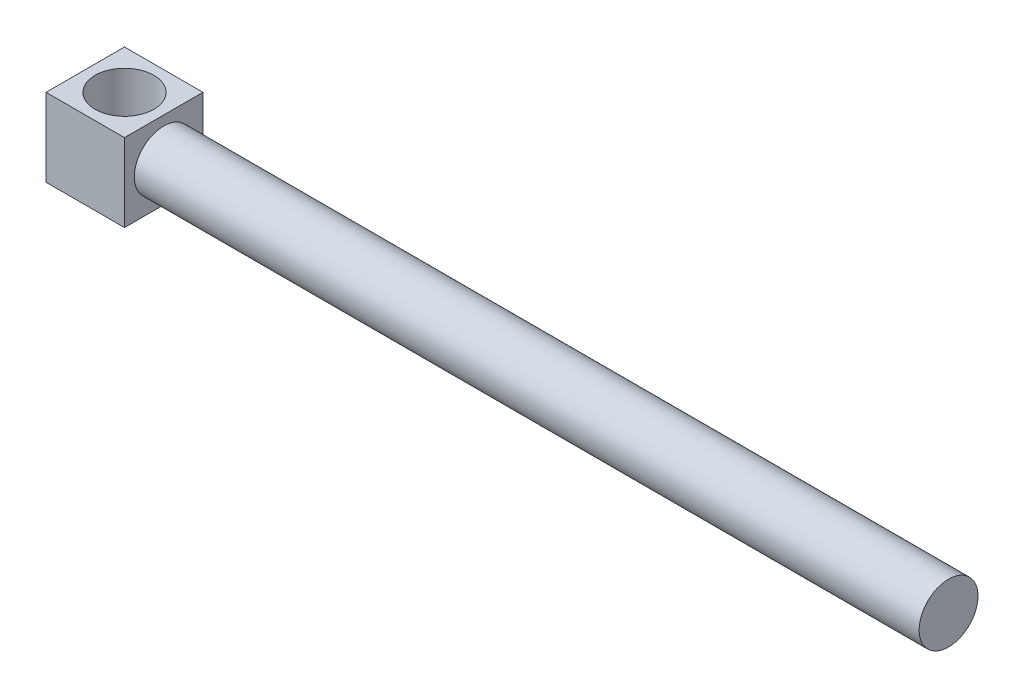
from build123d import *

# Parameters (mm, degrees)
SKETCH1_W           = 20
SKETCH1_H           = 19.85211399
BOSS_EXTRUDE1_DEPTH = 20
SKETCH2_R           = 7.5
CUT_EXTRUDE1_DEPTH  = 20
SKETCH3_R           = 7.5
BOSS_EXTRUDE2_DEPTH = 200


with BuildPart() as part:
    # Sketch1 → Boss-Extrude1 (new body)
    with BuildSketch(Plane(origin=(0, 0, 0), x_dir=(0, 0, -1), z_dir=(1, 0, 0))):
        with Locations((10, 9.926056995)):
            Rectangle(SKETCH1_W, SKETCH1_H)
    extrude(amount=BOSS_EXTRUDE1_DEPTH)

    # Sketch2 → Cut-Extrude1 (cut)
    with BuildSketch(Plane(origin=(0, 19.85211399, 0), x_dir=(1, 0, 0), z_dir=(0, 1, 0))):
        with Locations(Location((10, 10, 0), (0, 0, 270))):
            Circle(SKETCH2_R)
    extrude(amount=-CUT_EXTRUDE1_DEPTH, mode=Mode.SUBTRACT)

    # Sketch3 → Boss-Extrude2 (add)
    with BuildSketch(Plane(origin=(20, 0, 0), x_dir=(0, 0, -1), z_dir=(1, 0, 0))):
        with Locations((10, 9.926056995)):
            Circle(SKETCH3_R)
    extrude(amount=BOSS_EXTRUDE2_DEPTH)


solid = part.part
